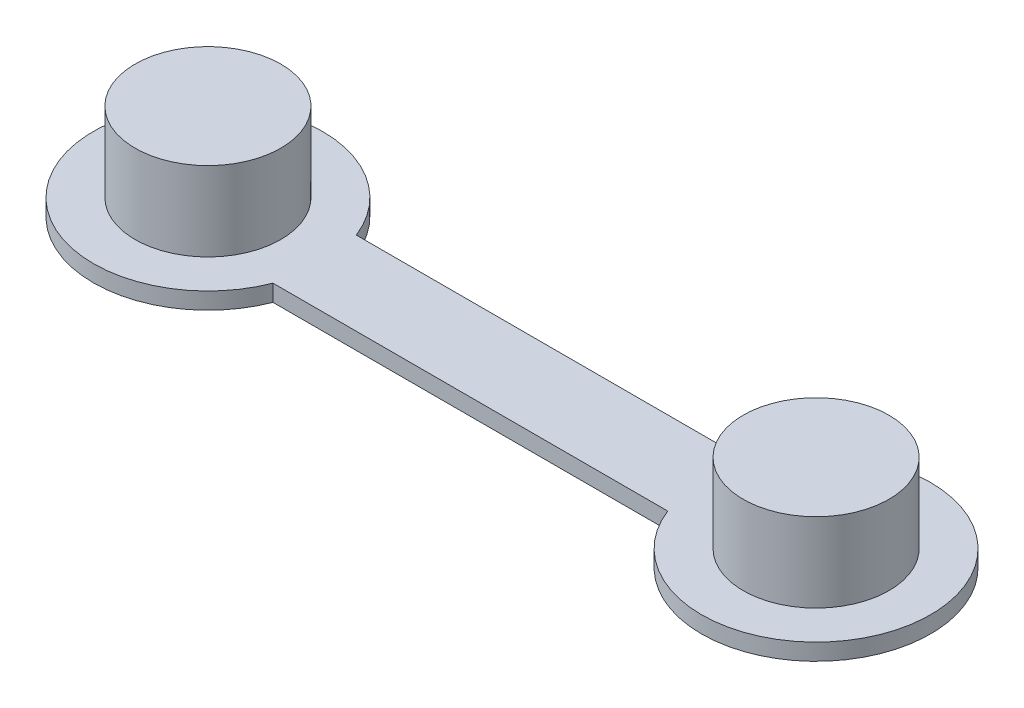
from build123d import *

# Parameters (mm, degrees)
BOSS_EXTRUDE1_DEPTH = 0.4
SKETCH2_R           = 1.75
BOSS_EXTRUDE2_DEPTH = 1.9


with BuildPart() as part:
    # Sketch1 → Boss-Extrude1 (new body)
    with BuildSketch(Plane(origin=(0, 0, 0), x_dir=(1, 0, 0), z_dir=(0, 1, 0))):
        with BuildLine():
            Line((2.561737691, 1), (12.038262309, 1))
            ThreePointArc((12.038262309, 1), (17.35, 0), (12.038262309, -1))
            Line((12.038262309, -1), (2.561737691, -1))
            ThreePointArc((2.561737691, -1), (-2.75, 0), (2.561737691, 1))
        make_face()
    extrude(amount=BOSS_EXTRUDE1_DEPTH)

    # Sketch2 → Boss-Extrude2 (add)
    with BuildSketch(Plane(origin=(0, 0.4, 0), x_dir=(1, 0, 0), z_dir=(0, 1, 0))):
        with Locations(Location((0, 0, 0), (0, 0, 90))):
            Circle(SKETCH2_R)
        with Locations(Location((14.6, 0, 0), (0, 0, 90))):
            Circle(SKETCH2_R)
    extrude(amount=BOSS_EXTRUDE2_DEPTH)


solid = part.part
